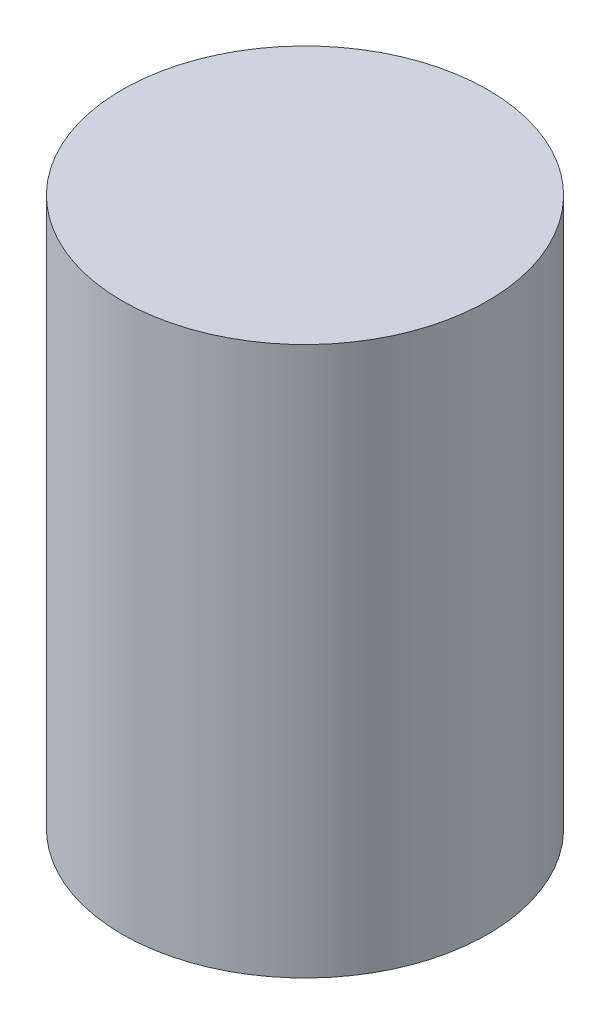
from build123d import *

# Parameters (mm, degrees)
SKETCH2_R           = 10
BOSS_EXTRUDE1_DEPTH = 30


with BuildPart() as part:
    # Sketch2 → Boss-Extrude1 (new body)
    with BuildSketch(Plane(origin=(0, 0, 0), x_dir=(1, 0, 0), z_dir=(0, 1, 0))):
        with Locations(Location((0, 0, 0), (0, 0, 270))):
            Circle(SKETCH2_R)
    extrude(amount=BOSS_EXTRUDE1_DEPTH)


solid = part.part
